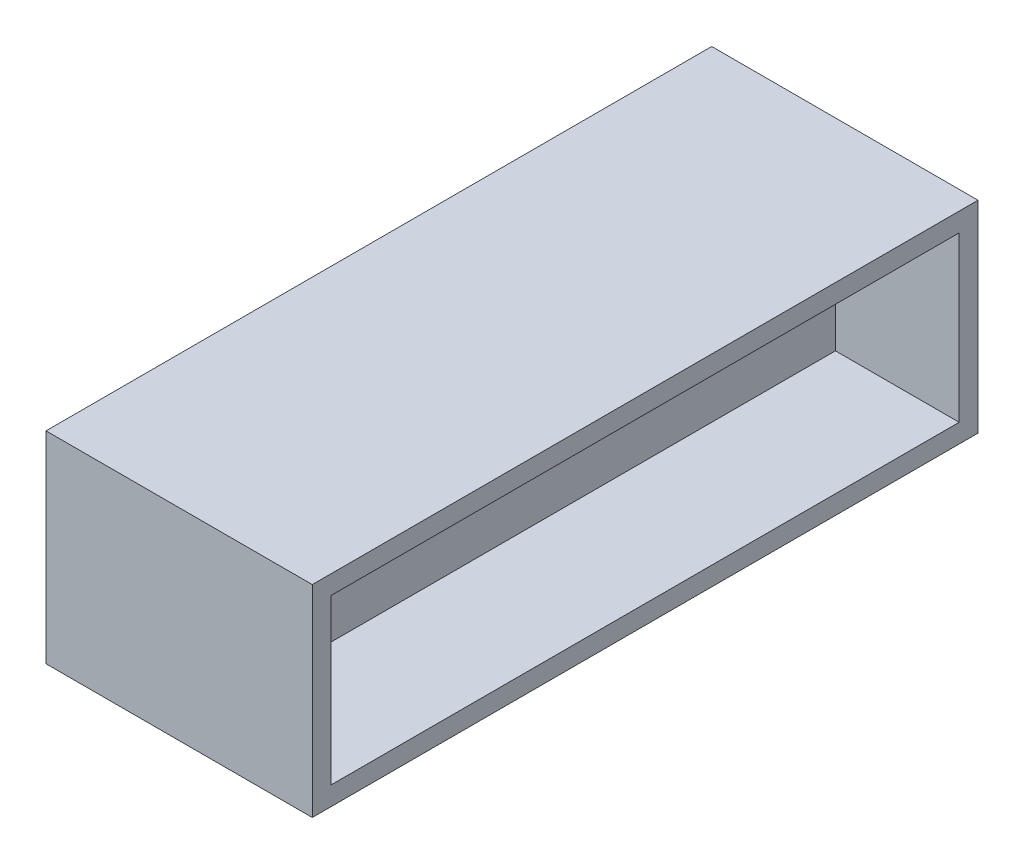
from build123d import *

# Parameters (mm, degrees)
SKETCH1_W           = 42.4
SKETCH1_H           = 32.12
BOSS_EXTRUDE1_DEPTH = 3
BOSS_EXTRUDE2_DEPTH = 100
SKETCH3_W           = 42.4
SKETCH3_H           = 32.12
BOSS_EXTRUDE3_DEPTH = 3


with BuildPart() as part:
    # Sketch1 → Boss-Extrude1 (new body)
    with BuildSketch(Plane.XY):
        Rectangle(SKETCH1_W, SKETCH1_H)
    extrude(amount=BOSS_EXTRUDE1_DEPTH)

    # Sketch2 → Boss-Extrude2 (add)
    with BuildSketch(Plane.XY.offset(3)):
        Polygon((-21.2, 16.06), (-21.2, 13.06), (-1.5, 13.06), (-1.5, -13.06), (-21.2, -13.06), (-21.2, -16.06), (21.2, -16.06), (21.2, -13.06), (1.5, -13.06), (1.5, 13.06), (21.2, 13.06), (21.2, 16.06), align=None)
    extrude(amount=BOSS_EXTRUDE2_DEPTH)

    # Sketch3 → Boss-Extrude3 (add)
    with BuildSketch(Plane.XY.offset(103)):
        Rectangle(SKETCH3_W, SKETCH3_H)
    extrude(amount=BOSS_EXTRUDE3_DEPTH)


solid = part.part
